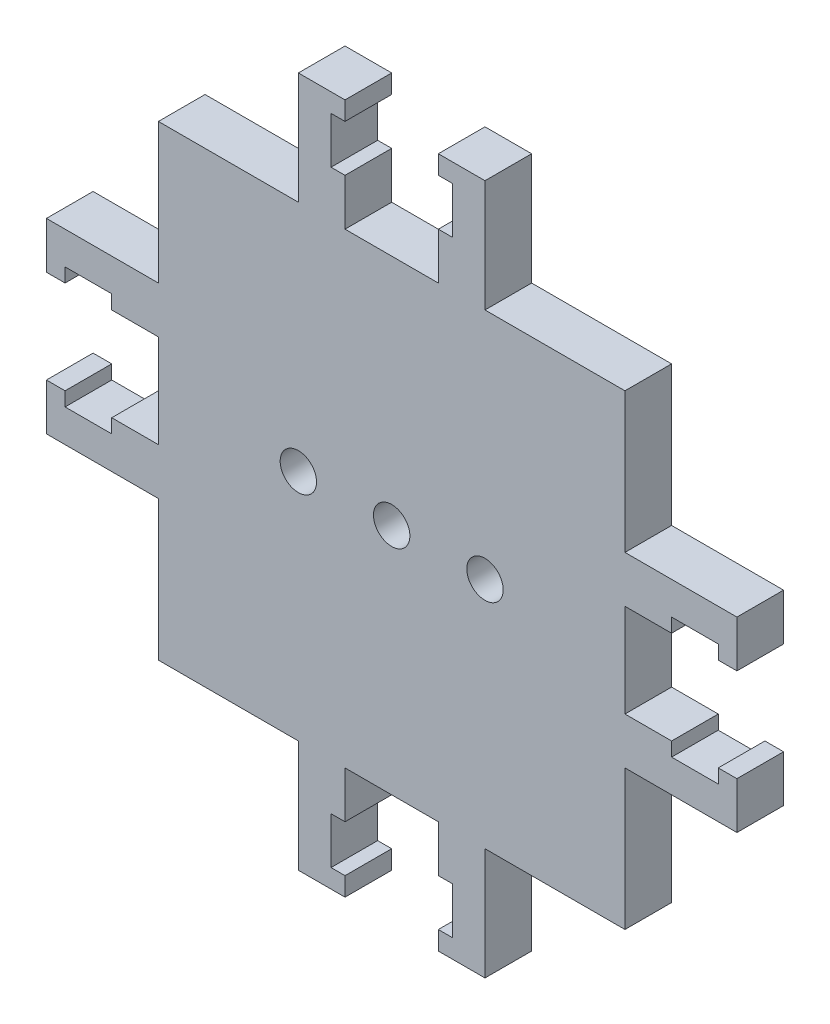
from build123d import *

# Parameters (mm, degrees)
ESQUISSE1_R        = 1.95
BOSS_EXTRU_1_DEPTH = 5


with BuildPart() as part:
    # Esquisse1 → Boss.-Extru.1 (new body)
    with BuildSketch(Plane.XY):
        Polygon((-10, 25), (-25, 25), (-25, 10), (-30, 10), (-37, 10), (-37, 5), (-35, 5), (-35, 6.5), (-30, 6.5), (-30, 5), (-25, 5), (-25, 0), (-25, -5), (-30, -5), (-30, -6.5), (-35, -6.5), (-35, -5), (-37, -5), (-37, -10), (-30, -10), (-25, -10), (-25, -25), (-10, -25), (-10, -30), (-10, -37), (-5, -37), (-5, -35), (-6.5, -35), (-6.5, -30), (-5, -30), (-5, -25), (0, -25), (5, -25), (5, -30), (6.5, -30), (6.5, -35), (5, -35), (5, -37), (10, -37), (10, -30), (10, -25), (25, -25), (25, -10), (30, -10), (37, -10), (37, -5), (35, -5), (35, -6.5), (30, -6.5), (30, -5), (25, -5), (25, 0), (25, 5), (30, 5), (30, 6.5), (35, 6.5), (35, 5), (37, 5), (37, 10), (30, 10), (25, 10), (25, 25), (10, 25), (10, 30), (10, 37), (5, 37), (5, 35), (6.5, 35), (6.5, 30), (5, 30), (5, 25), (0, 25), (-5, 25), (-5, 30), (-6.5, 30), (-6.5, 35), (-5, 35), (-5, 37), (-10, 37), (-10, 30), align=None)
        with Locations((-10, 0)):
            Circle(ESQUISSE1_R, mode=Mode.SUBTRACT)
        Circle(ESQUISSE1_R, mode=Mode.SUBTRACT)
        with Locations((10, 0)):
            Circle(ESQUISSE1_R, mode=Mode.SUBTRACT)
    extrude(amount=BOSS_EXTRU_1_DEPTH)


solid = part.part
